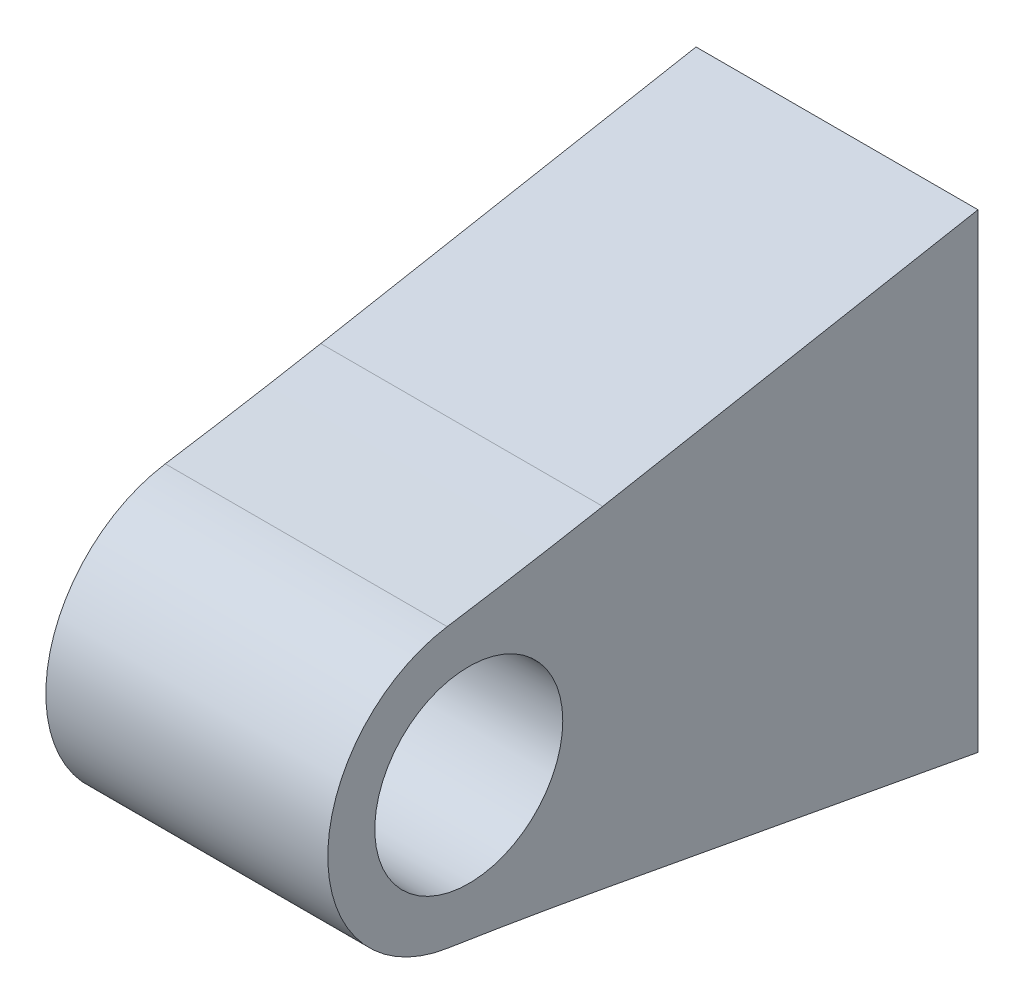
from build123d import *

# Parameters (mm, degrees)
SKETCH1_R           = 5
BOSS_EXTRUDE1_DEPTH = 15
FILLET1_R           = 290
SKETCH3_R           = 2.5
CUT_EXTRUDE2_DEPTH  = 5


with BuildPart() as part:
    # Sketch1 → Boss-Extrude1 (new body)
    with BuildSketch(Plane(origin=(0, 0, 0), x_dir=(0, 0, -1), z_dir=(1, 0, 0))):
        with BuildLine():
            Line((-4.221556886, 7.5), (22.866991249, 12.5))
            Line((22.866991249, 12.5), (22.866991249, -12.5))
            Line((22.866991249, -12.5), (-4.221556886, -7.5))
            ThreePointArc((-4.221556886, -7.5), (-11.721556886, 0), (-4.221556886, 7.5))
        make_face()
        with Locations((-4.221556886, 0)):
            Circle(SKETCH1_R, mode=Mode.SUBTRACT)
    extrude(amount=BOSS_EXTRUDE1_DEPTH)

    # Fillet1
    fillet1_edges = [part.edges().sort_by_distance(p)[0] for p in [
        (7.5, -7.5, 4.221556886),
        (7.5, 7.5, 4.221556886),
    ]]
    fillet(fillet1_edges, radius=FILLET1_R)

    # Sketch3 → Cut-Extrude2 (cut)
    with BuildSketch(Plane(origin=(0, 0, -22.866991249), x_dir=(-1, 0, 0), z_dir=(0, 0, -1))):
        with Locations((-7.5, 0)):
            Circle(SKETCH3_R)
    extrude(amount=-CUT_EXTRUDE2_DEPTH, mode=Mode.SUBTRACT)


solid = part.part
